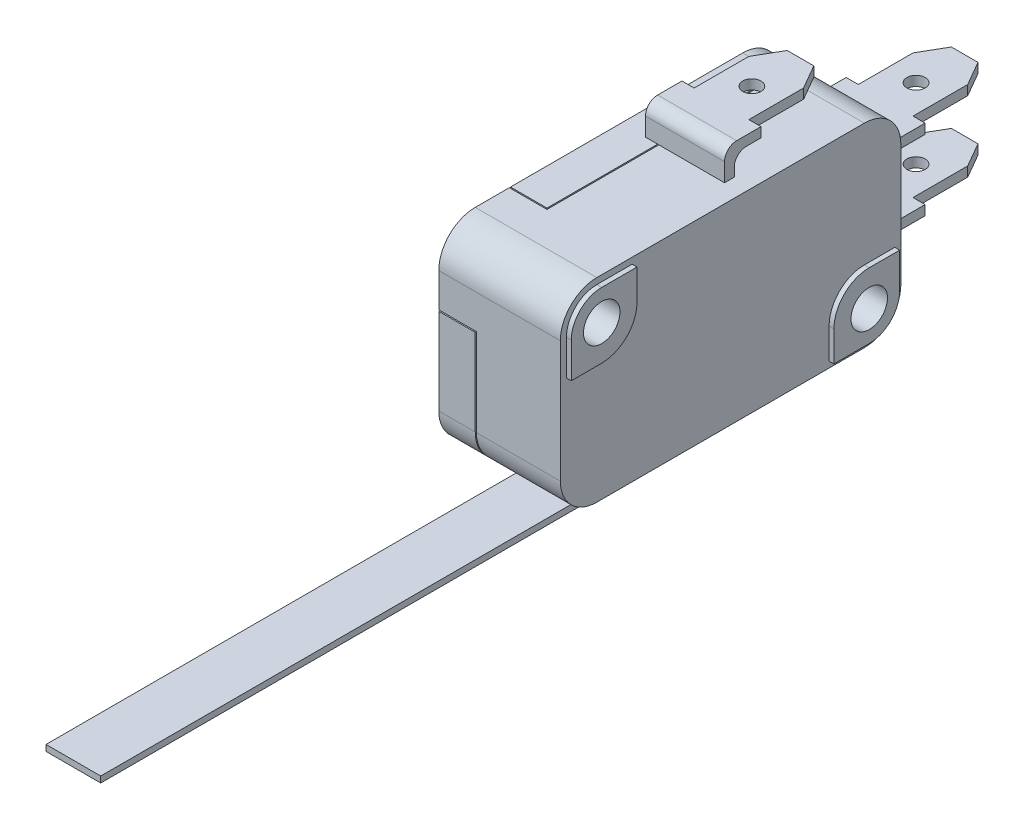
from build123d import *

# Parameters (mm, degrees)
SKETCH_1_W          = 28
SKETCH_1_H          = 16
SKETCH_1_R          = 1.5
EXTRUDE_1_DEPTH     = 10
FILLET_1_R          = 3
SKETCH_2_R          = 1.5
EXTRUDE_2_DEPTH     = 0.4
CUT_EXTRUDE_1_DEPTH = 0.1
CUT_EXTRUDE_2_DEPTH = 3
CUT_EXTRUDE_3_DEPTH = 0.1
CUT_EXTRUDE_4_DEPTH = 0.1
SKETCH_7_W          = 2.9
SKETCH_7_H          = 0.1
CUT_EXTRUDE_5_DEPTH = 0.1
SKETCH_8_W          = 2.9
SKETCH_8_H          = 0.1
CUT_EXTRUDE_6_DEPTH = 0.1
EXTRUDE_3_DEPTH     = 4.5
SKETCH_11_W         = 10
SKETCH_11_H         = 0.8
EXTRUDE_4_DEPTH     = 6.5
SKETCH_12_R         = 0.75
CUT_EXTRUDE_7_DEPTH = 53.388166603
FILLET_2_R          = 1
SKETCH_13_R         = 0.75
CUT_EXTRUDE_8_DEPTH = 2


with BuildPart() as part:
    # 草图1 → 凸台-拉伸1 (new body)
    with BuildSketch(Plane(origin=(0, 0, 0), x_dir=(0, 0, -1), z_dir=(1, 0, 0))):
        Rectangle(SKETCH_1_W, SKETCH_1_H)
        with Locations((11, -5)):
            Circle(SKETCH_1_R, mode=Mode.SUBTRACT)
        with Locations((-11, 5)):
            Circle(SKETCH_1_R, mode=Mode.SUBTRACT)
    extrude(amount=EXTRUDE_1_DEPTH)

    # 圆角1
    fillet_1_edges = [part.edges().sort_by_distance(p)[0] for p in [
        (5, 8, -14),
        (5, 8, 14),
        (5, -8, 14),
        (5, -8, -14),
    ]]
    fillet(fillet_1_edges, radius=FILLET_1_R)

    # 草图2 → 凸台-拉伸2 (add)
    # profile 1 of 2: a face of its own
    with BuildSketch(Plane(origin=(10, 0, 0), x_dir=(0, 0, -1), z_dir=(1, 0, 0))):
        with BuildLine():
            Line((13.5, -5), (13.5, -2.1))
            Line((13.5, -2.1), (11, -2.1))
            ThreePointArc((11, -2.1), (8.949390335, -2.949390335), (8.1, -5))
            Line((8.1, -5), (8.1, -7.5))
            Line((8.1, -7.5), (11, -7.5))
            ThreePointArc((11, -7.5), (12.767766953, -6.767766953), (13.5, -5))
        make_face()
        with Locations((11, -5)):
            Circle(SKETCH_2_R, mode=Mode.SUBTRACT)
    # profile 2 of 2: a face of its own
    with BuildSketch(Plane(origin=(10, 0, 0), x_dir=(0, 0, -1), z_dir=(1, 0, 0))):
        with BuildLine():
            Line((-11, 2.1), (-13.5, 2.1))
            Line((-13.5, 2.1), (-13.5, 5))
            ThreePointArc((-13.5, 5), (-12.767766953, 6.767766953), (-11, 7.5))
            Line((-11, 7.5), (-8.1, 7.5))
            Line((-8.1, 7.5), (-8.1, 5))
            ThreePointArc((-8.1, 5), (-8.949390335, 2.949390335), (-11, 2.1))
        make_face()
        with Locations((-11, 5)):
            Circle(SKETCH_2_R, mode=Mode.SUBTRACT)
    extrude(amount=EXTRUDE_2_DEPTH)

    # 草图3 → 切除-拉伸1 (cut)
    with BuildSketch(Plane.ZY):
        with BuildLine():
            Line((-13.5, -2.1), (-11, -2.1))
            ThreePointArc((-11, -2.1), (-8.949390335, -2.949390335), (-8.1, -5))
            Line((-8.1, -5), (-8.1, -7.5))
            Line((-8.1, -7.5), (-8.1, -8))
            Line((-8.1, -8), (-8.2, -8))
            Line((-8.2, -8), (-8.2, -7.5))
            Line((-8.2, -7.5), (-8.2, -5))
            ThreePointArc((-8.2, -5), (-9.020101013, -3.020101013), (-11, -2.2))
            Line((-11, -2.2), (-13.5, -2.2))
            Line((-13.5, -2.2), (-14, -2.2))
            Line((-14, -2.2), (-14, -2.1))
            Line((-14, -2.1), (-13.5, -2.1))
        make_face()
        with BuildLine():
            Line((13.5, 2.1), (11, 2.1))
            ThreePointArc((11, 2.1), (8.949390335, 2.949390335), (8.1, 5))
            Line((8.1, 5), (8.1, 7.5))
            Line((8.1, 7.5), (8.1, 8))
            Line((8.1, 8), (8.2, 8))
            Line((8.2, 8), (8.2, 7.5))
            Line((8.2, 7.5), (8.2, 5))
            ThreePointArc((8.2, 5), (9.020101013, 3.020101013), (11, 2.2))
            Line((11, 2.2), (13.5, 2.2))
            Line((13.5, 2.2), (14, 2.2))
            Line((14, 2.2), (14, 2.1))
            Line((14, 2.1), (13.5, 2.1))
        make_face()
    extrude(amount=-CUT_EXTRUDE_1_DEPTH, mode=Mode.SUBTRACT)

    # 草图4 → 切除-拉伸2 (cut)
    with BuildSketch(Plane(origin=(0, 8, 0), x_dir=(1, 0, 0), z_dir=(0, 1, 0))):
        Polygon((0, -8.2), (3.1, -8.2), (3.1, 14), (3, 14), (3, -8.1), (0, -8.1), align=None)
    extrude(amount=-CUT_EXTRUDE_2_DEPTH, mode=Mode.SUBTRACT)

    # 草图5 → 切除-拉伸3 (cut)
    with BuildSketch(Plane(origin=(0, 0, -14), x_dir=(-1, 0, 0), z_dir=(0, 0, -1))):
        Polygon((-3, 5), (-3, -2.1), (-0.1, -2.1), (-0.1, -2.2), (-3.1, -2.2), (-3.1, 5), align=None)
    extrude(amount=-CUT_EXTRUDE_3_DEPTH, mode=Mode.SUBTRACT)

    # 草图6 → 切除-拉伸4 (cut)
    with BuildSketch(Plane.ZY.offset(-3.1)):
        with BuildLine():
            Line((-8.2, -8), (11, -8))
            ThreePointArc((11, -8), (13.121320344, -7.121320344), (14, -5))
            Line((14, -5), (14, 2.1))
            Line((14, 2.1), (14, 2.2))
            Line((14, 2.2), (13.9, 2.2))
            Line((13.9, 2.2), (13.9, 2.1))
            Line((13.9, 2.1), (13.9, -5))
            ThreePointArc((13.9, -5), (13.050609665, -7.050609665), (11, -7.9))
            Line((11, -7.9), (-8.2, -7.9))
            Line((-8.2, -7.9), (-8.2, -8))
        make_face()
    extrude(amount=CUT_EXTRUDE_4_DEPTH, mode=Mode.SUBTRACT)

    # 草图7 → 切除-拉伸5 (cut)
    with BuildSketch(Plane.XY.offset(14)):
        with Locations((1.55, 2.15)):
            Rectangle(SKETCH_7_W, SKETCH_7_H)
    extrude(amount=-CUT_EXTRUDE_5_DEPTH, mode=Mode.SUBTRACT)

    # 草图8 → 切除-拉伸6 (cut)
    with BuildSketch(Plane.XZ.offset(8)):
        with Locations((1.55, -8.15)):
            Rectangle(SKETCH_8_W, SKETCH_8_H)
    extrude(amount=-CUT_EXTRUDE_6_DEPTH, mode=Mode.SUBTRACT)

    # 草图10 → 凸台-拉伸3 (add)
    with BuildSketch(Plane.ZY.offset(-3.1)):
        Polygon((-2.1, -8), (-2.6, -8), (-2.6, -10), (49.4, -10), (49.4, -9.5), (-2.1, -9.5), align=None)
        with BuildLine():
            Line((11, -8), (8.2, -8))
            Line((8.2, -8), (8.2, -8.08))
            ThreePointArc((8.2, -8.08), (9.371579858, -9.461240109), (10.925463198, -8.53071866))
            ThreePointArc((10.925463198, -8.53071866), (10.981240109, -8.308420142), (11, -8.08))
            Line((11, -8.08), (11, -8))
        make_face()
    extrude(amount=-EXTRUDE_3_DEPTH)

    # 草图11 → 凸台-拉伸4 (add)
    with BuildSketch(Plane.ZY.offset(-2)):
        with Locations((-19, 3.6)):
            Rectangle(SKETCH_11_W, SKETCH_11_H)
        with Locations((-19, -2.2)):
            Rectangle(SKETCH_11_W, SKETCH_11_H)
        Polygon((-1, 8), (-1, 10.5), (-10.5, 10.5), (-10.5, 9.7), (-1.8, 9.7), (-1.8, 8), align=None)
    extrude(amount=-EXTRUDE_4_DEPTH)

    # 草图12 → 切除-拉伸7 (cut, through all)
    with BuildSketch(Plane(origin=(0, 4, 0), x_dir=(1, 0, 0), z_dir=(0, 1, 0))):
        with Locations((5.25, 20)):
            Circle(SKETCH_12_R)
        Polygon((2, 17.5), (3, 17.5), (3, 22), (4.154700538, 24), (3, 24), (2, 24), align=None)
        Polygon((8.5, 24), (8.5, 17.5), (7.5, 17.5), (7.5, 22), (6.345299462, 24), (7.5, 24), align=None)
    extrude(amount=-CUT_EXTRUDE_7_DEPTH, mode=Mode.SUBTRACT)

    # 圆角2
    fillet_2_edges = [part.edges().sort_by_distance(p)[0] for p in [
        (5.35, -9.5, -2.1),
        (5.35, -10, -2.6),
        (5.25, 9.7, -1.8),
        (5.25, 10.5, -1),
    ]]
    fillet(fillet_2_edges, radius=FILLET_2_R)

    # 草图13 → 切除-拉伸8 (cut)
    with BuildSketch(Plane(origin=(0, 10.5, 0), x_dir=(1, 0, 0), z_dir=(0, 1, 0))):
        with Locations((5.25, 6.5)):
            Circle(SKETCH_13_R)
        Polygon((8.5, 10.5), (6.345299462, 10.5), (7.5, 8.5), (7.5, 4), (8.5, 4), align=None)
        Polygon((3, 4), (2, 4), (2, 10.5), (4.154700538, 10.5), (3, 8.5), align=None)
    extrude(amount=-CUT_EXTRUDE_8_DEPTH, mode=Mode.SUBTRACT)


solid = part.part
